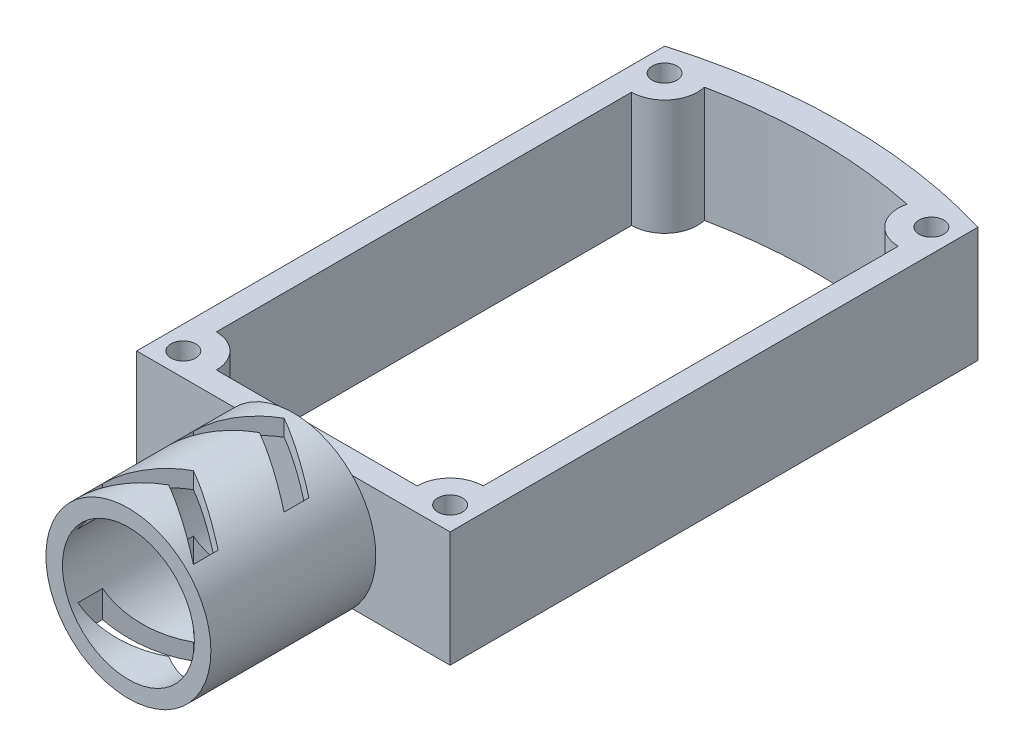
from build123d import *

# Parameters (mm, degrees)
SKETCH_1_R          = 1.5
EXTRUDE_1_DEPTH     = 14
SKETCH_2_R          = 10
SKETCH_2_R_2        = 8
EXTRUDE_2_DEPTH     = 20
CUT_EXTRUDE_4_DEPTH = 20
SKETCH_6_R          = 1.5
CUT_EXTRUDE_5_DEPTH = 10


with BuildPart() as part:
    # 草图1 → 凸台-拉伸1 (new body)
    with BuildSketch(Plane(origin=(0, 0, 0), x_dir=(1, 0, 0), z_dir=(0, 1, 0))):
        with BuildLine():
            Line((0, 0), (19, 0))
            Line((19, 0), (19, 64))
            ThreePointArc((19, 64), (0, 66.760766922), (-19, 64))
            Line((-19, 64), (-19, 0))
            Line((-19, 0), (0, 0))
        make_face()
        with Locations(Location((-16.171572875, 61.171572875, 0), (0, 0, 270))):
            Circle(SKETCH_1_R, mode=Mode.SUBTRACT)
        with Locations(Location((16.171572875, 61.171572875, 0), (0, 0, 270))):
            Circle(SKETCH_1_R, mode=Mode.SUBTRACT)
        with Locations(Location((-16.171572875, 2.828427125, 0), (0, 0, 270))):
            Circle(SKETCH_1_R, mode=Mode.SUBTRACT)
        with Locations(Location((16.171572875, 2.828427125, 0), (0, 0, 270))):
            Circle(SKETCH_1_R, mode=Mode.SUBTRACT)
        with BuildLine():
            Line((-16.171572875, 57.171572875), (-16.171572875, 6.828427125))
            ThreePointArc((-16.171572875, 6.828427125), (-13.343145751, 5.656854249), (-12.171572875, 2.828427125))
            Line((-12.171572875, 2.828427125), (12.171572875, 2.828427125))
            ThreePointArc((12.171572875, 2.828427125), (13.343145751, 5.656854249), (16.171572875, 6.828427125))
            Line((16.171572875, 6.828427125), (16.171572875, 57.171572875))
            ThreePointArc((16.171572875, 57.171572875), (13.0281615, 58.697918711), (12.283716556, 62.112090413))
            ThreePointArc((12.283716556, 62.112090413), (0, 63.371324523), (-12.283716556, 62.112090413))
            ThreePointArc((-12.283716556, 62.112090413), (-13.0281615, 58.697918711), (-16.171572875, 57.171572875))
        make_face(mode=Mode.SUBTRACT)
    extrude(amount=EXTRUDE_1_DEPTH)

    # 草图2 → 凸台-拉伸2 (add)
    with BuildSketch(Plane.XY):
        with Locations(Location((0, 7, 0), (0, 0, 135.572995999))):
            Circle(SKETCH_2_R)
        with Locations(Location((0, 7, 0), (0, 0, 241.044975628))):
            Circle(SKETCH_2_R_2, mode=Mode.SUBTRACT)
    extrude(amount=EXTRUDE_2_DEPTH)

    # 草图3 → 切除-拉伸4 (cut, symmetric)
    with BuildSketch(Plane(origin=(0, 0, 0), x_dir=(1, 0, 0), z_dir=(0, 1, 0))):
        Polygon((0, -1.124822793), (7, -5.124822793), (7, -8.124822793), (0, -4.124822793), (-7, -8.124822793), (-7, -5.124822793), align=None)
        Polygon((0, -12.124822793), (7, -16.124822793), (7, -19.124822793), (0, -15.124822793), (-7, -19.124822793), (-7, -16.124822793), align=None)
    extrude(amount=CUT_EXTRUDE_4_DEPTH, both=True, mode=Mode.SUBTRACT)

    # 草图6 → 切除-拉伸5 (cut)
    with BuildSketch(Plane(origin=(0, 0, 0), x_dir=(1, 0, 0), z_dir=(0, 1, 0))):
        with Locations(Location((0, -10, 0), (0, 0, 270))):
            Circle(SKETCH_6_R)
    extrude(amount=-CUT_EXTRUDE_5_DEPTH, mode=Mode.SUBTRACT)


solid = part.part
